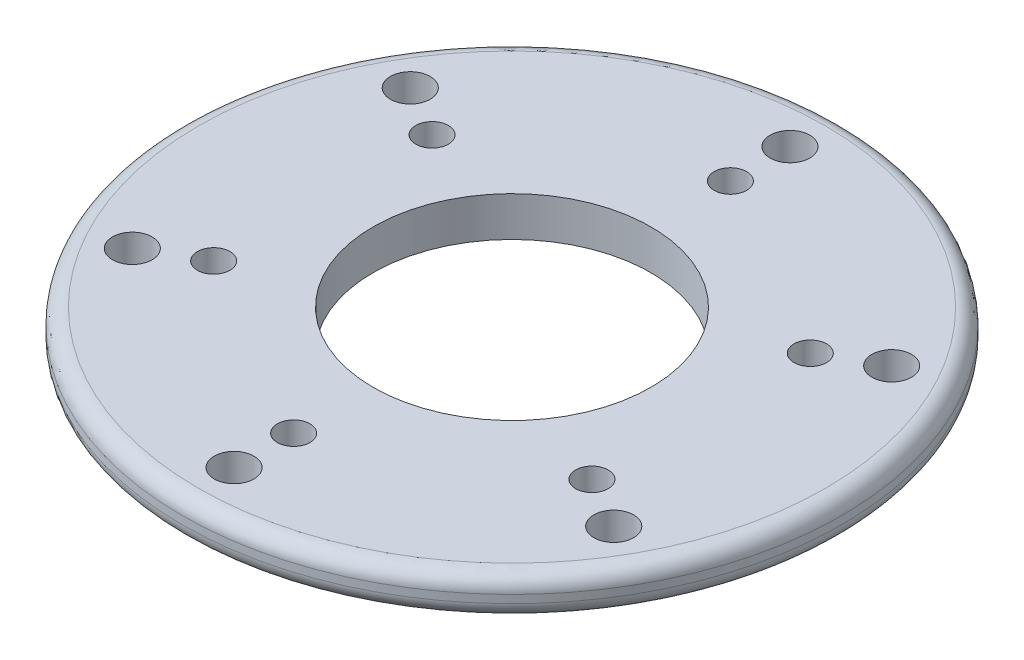
from build123d import *

# Parameters (mm, degrees)
SKETCH1_R             = 41.5
MAIN_PLATE_DEPTH      = 5
SKETCH2_R             = 2.05
CUT_EXTRUDE_G27_DEPTH = 59.902461748
SKETCH3_R             = 2.5
MOMO_SPARKO_DEPTH     = 59.902461748
SKETCH4_R             = 17.5
CENTER_HOLE_DEPTH     = 59.902461748
FILLET1_R             = 2
FILLET2_R             = 2


with BuildPart() as part:
    # Sketch1 → Main Plate (new body)
    with BuildSketch(Plane(origin=(0, 0, 0), x_dir=(1, 0, 0), z_dir=(0, 1, 0))):
        with Locations(Location((0, 0, 0), (0, 0, 270))):
            Circle(SKETCH1_R)
    extrude(amount=MAIN_PLATE_DEPTH)

    # Sketch2 → Cut-Extrude G27 (cut, through all)
    with BuildSketch(Plane(origin=(0, 5, 0), x_dir=(1, 0, 0), z_dir=(0, 1, 0))):
        with Locations(Location((0, 27.5, 0), (0, 0, 270))):
            Circle(SKETCH2_R)
        with Locations(Location((23.815698604, 13.75, 0), (0, 0, 270))):
            Circle(SKETCH2_R)
        with Locations(Location((23.815698604, -13.75, 0), (0, 0, 270))):
            Circle(SKETCH2_R)
        with Locations(Location((0, -27.5, 0), (0, 0, 270))):
            Circle(SKETCH2_R)
        with Locations(Location((-23.815698604, -13.75, 0), (0, 0, 270))):
            Circle(SKETCH2_R)
        with Locations(Location((-23.815698604, 13.75, 0), (0, 0, 270))):
            Circle(SKETCH2_R)
    extrude(amount=-CUT_EXTRUDE_G27_DEPTH, mode=Mode.SUBTRACT)

    # Sketch3 → Momo - Sparko (cut, through all)
    with BuildSketch(Plane(origin=(0, 5, 0), x_dir=(1, 0, 0), z_dir=(0, 1, 0))):
        with Locations(Location((0, 35, 0), (0, 0, 270))):
            Circle(SKETCH3_R)
        with Locations(Location((30.310889132, 17.5, 0), (0, 0, 270))):
            Circle(SKETCH3_R)
        with Locations(Location((30.310889132, -17.5, 0), (0, 0, 270))):
            Circle(SKETCH3_R)
        with Locations(Location((0, -35, 0), (0, 0, 270))):
            Circle(SKETCH3_R)
        with Locations(Location((-30.310889132, -17.5, 0), (0, 0, 270))):
            Circle(SKETCH3_R)
        with Locations(Location((-30.310889132, 17.5, 0), (0, 0, 270))):
            Circle(SKETCH3_R)
    extrude(amount=-MOMO_SPARKO_DEPTH, mode=Mode.SUBTRACT)

    # Sketch4 → Center Hole (cut, through all)
    with BuildSketch(Plane(origin=(0, 5, 0), x_dir=(1, 0, 0), z_dir=(0, 1, 0))):
        with Locations(Location((0, 0, 0), (0, 0, 270))):
            Circle(SKETCH4_R)
    extrude(amount=-CENTER_HOLE_DEPTH, mode=Mode.SUBTRACT)

    # Fillet1
    fillet1_edges = [part.edges().sort_by_distance(p)[0] for p in [
        (0, 5, -41.5),
    ]]
    fillet(fillet1_edges, radius=FILLET1_R)

    # Fillet2
    fillet2_edges = [part.edges().sort_by_distance(p)[0] for p in [
        (0, 0, -41.5),
    ]]
    fillet(fillet2_edges, radius=FILLET2_R)


solid = part.part
